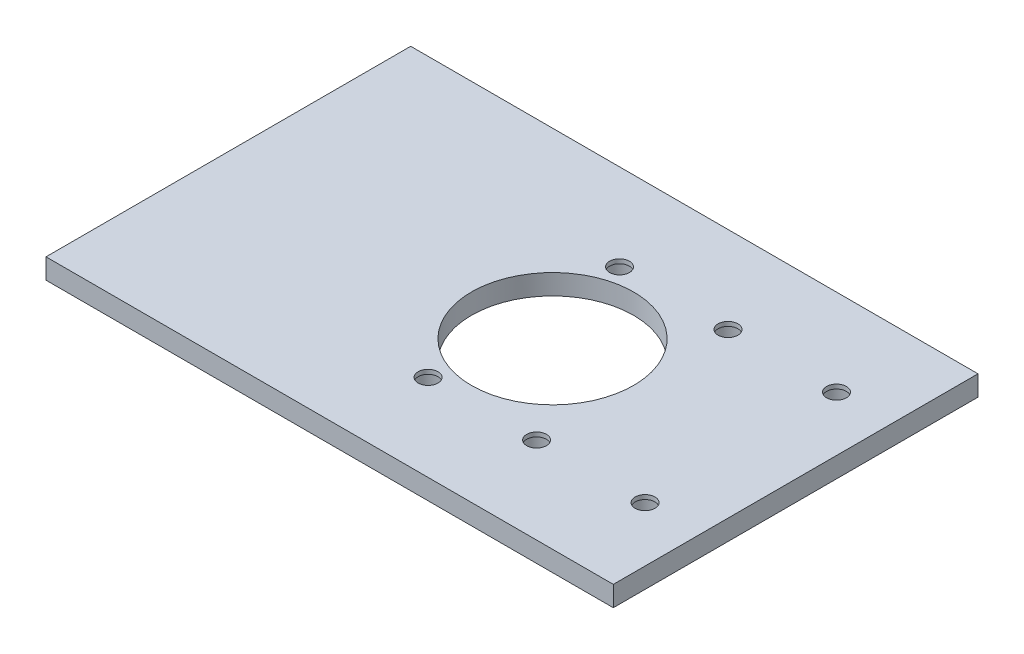
from build123d import *

# Parameters (mm, degrees)
SKETCH1_W                       = 88.9
SKETCH1_H                       = 57.15
BOSS_EXTRUDE1_DEPTH             = 1.5875
SKETCH2_R                       = 12.7
CUT_EXTRUDE1_DEPTH              = 3.175
CBORE_FOR_M2_5_SHCS1_AT_2_COUNT = 2
CBORE_FOR_M2_5_SHCS1_AT_2_PITCH = 17
CBORE_FOR_M2_5_SHCS1_AT_3_COUNT = 2
CBORE_FOR_M2_5_SHCS1_AT_3_PITCH = 34
CBORE_FOR_M2_5_SHCS1_AT_4_COUNT = 2
CBORE_FOR_M2_5_SHCS1_AT_4_PITCH = 30
CBORE_FOR_M2_5_SHCS1_AT_5_COUNT = 2
CBORE_FOR_M2_5_SHCS1_AT_5_PITCH = 34.481879299
CBORE_FOR_M2_5_SHCS1_AT_6_COUNT = 2
CBORE_FOR_M2_5_SHCS1_AT_6_PITCH = 45.343136195


with BuildPart() as part:
    # Sketch1 → Boss-Extrude1 (new, symmetric)
    with BuildSketch(Plane(origin=(0, 0, 0), x_dir=(1, 0, 0), z_dir=(0, 1, 0))):
        with Locations((-6.35, 0)):
            Rectangle(SKETCH1_W, SKETCH1_H)
    extrude(amount=BOSS_EXTRUDE1_DEPTH, both=True)

    # Sketch2 → Cut-Extrude1 (cut)
    with BuildSketch(Plane(origin=(0, 1.5875, 0), x_dir=(1, 0, 0), z_dir=(0, 1, 0))):
        with Locations(Location((0, 0, 0), (0, 0, 270))):
            Circle(SKETCH2_R)
    extrude(amount=-CUT_EXTRUDE1_DEPTH, mode=Mode.SUBTRACT)

    # Sketch10 → CBORE for M2.5 SHCS1 (revolve, cut)
    with BuildSketch(Plane(origin=(29.5, -1.5875, -15), x_dir=(0, 0, -1), z_dir=(1, 0, 0))):
        Polygon((0, 0), (0, 153.331333959), (1.55, 152.4), (1.55, 2.5), (2.75, 2.5), (2.75, 0.025), (2.775, 0), align=None)
    cbore_for_m2_5_shcs1 = revolve(axis=Axis((29.5, -7.9375, -15), (0, 1, 0)), mode=Mode.SUBTRACT)

    # CBORE for M2.5 SHCS1 at 2: CBORE for M2.5 SHCS1 ×2
    with Locations(*[(-i * CBORE_FOR_M2_5_SHCS1_AT_2_PITCH, 0, 0) for i in range(1, CBORE_FOR_M2_5_SHCS1_AT_2_COUNT)]):
        add(cbore_for_m2_5_shcs1, mode=Mode.SUBTRACT)

    # CBORE for M2.5 SHCS1 at 3: CBORE for M2.5 SHCS1 ×2
    with Locations(*[(-i * CBORE_FOR_M2_5_SHCS1_AT_3_PITCH, 0, 0) for i in range(1, CBORE_FOR_M2_5_SHCS1_AT_3_COUNT)]):
        add(cbore_for_m2_5_shcs1, mode=Mode.SUBTRACT)

    # CBORE for M2.5 SHCS1 at 4: CBORE for M2.5 SHCS1 ×2
    with Locations(*[(0, 0, i * CBORE_FOR_M2_5_SHCS1_AT_4_PITCH) for i in range(1, CBORE_FOR_M2_5_SHCS1_AT_4_COUNT)]):
        add(cbore_for_m2_5_shcs1, mode=Mode.SUBTRACT)

    # CBORE for M2.5 SHCS1 at 5: CBORE for M2.5 SHCS1 ×2
    with Locations(*[Vector(-0.49301257198088044, 0, 0.8700221858486122) * (i * CBORE_FOR_M2_5_SHCS1_AT_5_PITCH) for i in range(1, CBORE_FOR_M2_5_SHCS1_AT_5_COUNT)]):
        add(cbore_for_m2_5_shcs1, mode=Mode.SUBTRACT)

    # CBORE for M2.5 SHCS1 at 6: CBORE for M2.5 SHCS1 ×2
    with Locations(*[Vector(-0.7498378553650926, 0, 0.6616216370868463) * (i * CBORE_FOR_M2_5_SHCS1_AT_6_PITCH) for i in range(1, CBORE_FOR_M2_5_SHCS1_AT_6_COUNT)]):
        add(cbore_for_m2_5_shcs1, mode=Mode.SUBTRACT)


solid = part.part
